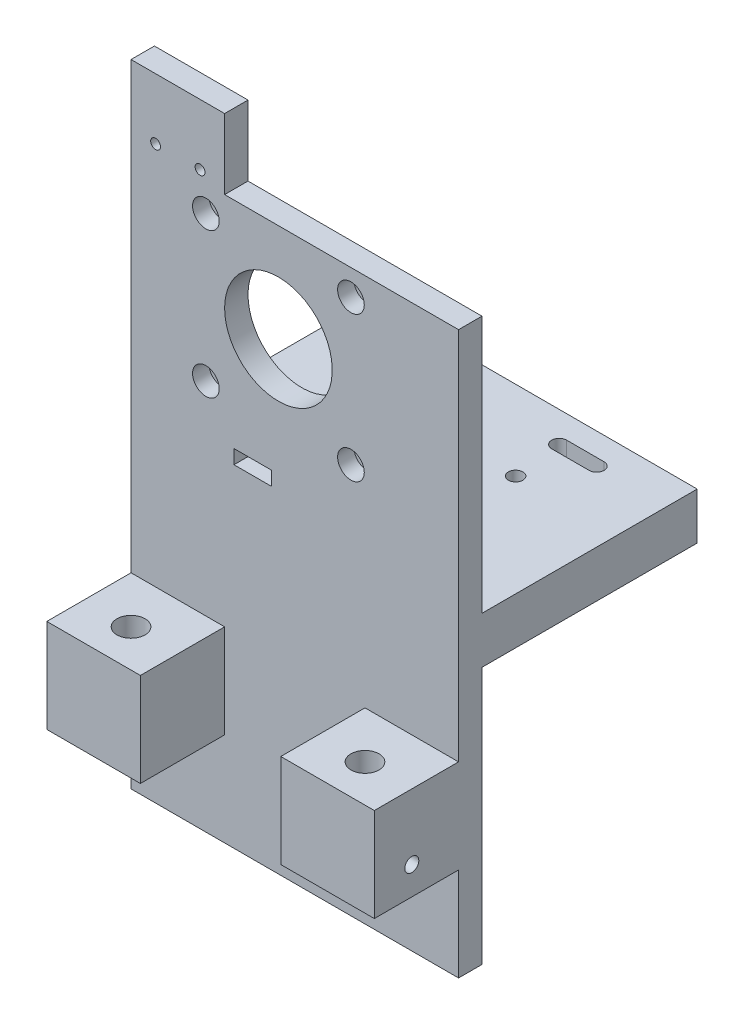
from build123d import *

# Parameters (mm, degrees)
SKETCH1_W           = 70
SKETCH1_H           = 120
BOSS_EXTRUDE1_DEPTH = 5
SKETCH2_W           = 20
SKETCH2_H           = 20
BOSS_EXTRUDE2_DEPTH = 18
CUT_EXTRUDE1_REACH  = 92.3
SKETCH3_R           = 3
CUT_EXTRUDE2_REACH  = 75.171
SKETCH4_R           = 11.5
SKETCH4_R_2         = 1.55
SKETCH5_W           = 20
SKETCH5_H           = 15
SKETCH5_R           = 1.05
BOSS_EXTRUDE3_DEPTH = 5
SKETCH6_W           = 70
SKETCH6_H           = 10
BOSS_EXTRUDE4_DEPTH = 46
SKETCH7_W           = 2.6
SKETCH7_H           = 5.7
CUT_EXTRUDE3_DEPTH  = 10
SKETCH8_R           = 1.5
CUT_EXTRUDE4_DEPTH  = 8
CUT_EXTRUDE5_START  = -8
SKETCH9_R           = 1.5
CUT_EXTRUDE5_DEPTH  = 8
SKETCH10_R          = 2.85
CUT_EXTRUDE6_DEPTH  = 3.5
CUT_EXTRUDE7_REACH  = 92.78
SKETCH11_R          = 1.55
CUT_EXTRUDE8_REACH  = 92.78
SKETCH14_W          = 8
SKETCH14_H          = 16
BOSS_EXTRUDE5_DEPTH = 4
CUT_EXTRUDE9_REACH  = 96.689
SKETCH15_W          = 8
SKETCH15_H          = 3


with BuildPart() as part:
    # Sketch1 → Boss-Extrude1 (new body)
    with BuildSketch(Plane.XY):
        Rectangle(SKETCH1_W, SKETCH1_H)
    extrude(amount=BOSS_EXTRUDE1_DEPTH)

    # Sketch2 → Boss-Extrude2 (add)
    with BuildSketch(Plane.XY.offset(5)):
        with Locations((-25, -30)):
            Rectangle(SKETCH2_W, SKETCH2_H)
        with Locations((25, -30)):
            Rectangle(SKETCH2_W, SKETCH2_H)
    extrude(amount=BOSS_EXTRUDE2_DEPTH)

    # Sketch3 → Cut-Extrude1 (cut, up to next)
    with BuildSketch(Plane(origin=(0, -20, 0), x_dir=(1, 0, 0), z_dir=(0, 1, 0)), mode=Mode.PRIVATE) as cut_extrude1_sk1:
        with Locations(Location((-25, -15, 0), (0, 0, 270))):
            Circle(SKETCH3_R)
    cut_extrude1_tool1 = extrude(cut_extrude1_sk1.sketch, amount=-CUT_EXTRUDE1_REACH, mode=Mode.PRIVATE) & part.part
    # Sketch3 → Cut-Extrude1 (cut, up to next)
    with BuildSketch(Plane(origin=(0, -20, 0), x_dir=(1, 0, 0), z_dir=(0, 1, 0)), mode=Mode.PRIVATE) as cut_extrude1_sk2:
        with Locations(Location((25, -15, 0), (0, 0, 270))):
            Circle(SKETCH3_R)
    cut_extrude1_tool2 = extrude(cut_extrude1_sk2.sketch, amount=-CUT_EXTRUDE1_REACH, mode=Mode.PRIVATE) & part.part
    add(cut_extrude1_tool1.solids().sort_by_distance((-25, -20, 15))[0], mode=Mode.SUBTRACT)
    add(cut_extrude1_tool2.solids().sort_by_distance((25, -20, 15))[0], mode=Mode.SUBTRACT)

    # Sketch4 → Cut-Extrude2 (cut, up to next)
    with BuildSketch(Plane(origin=(0, 0, 0), x_dir=(-1, 0, 0), z_dir=(0, 0, -1)), mode=Mode.PRIVATE) as cut_extrude2_sk1:
        with Locations((3.5, 39)):
            Circle(SKETCH4_R)
    cut_extrude2_tool1 = extrude(cut_extrude2_sk1.sketch, amount=-CUT_EXTRUDE2_REACH, mode=Mode.PRIVATE) & part.part
    # Sketch4 → Cut-Extrude2 (cut, up to next)
    with BuildSketch(Plane(origin=(0, 0, 0), x_dir=(-1, 0, 0), z_dir=(0, 0, -1)), mode=Mode.PRIVATE) as cut_extrude2_sk2:
        with Locations((-12, 54.5)):
            Circle(SKETCH4_R_2)
    cut_extrude2_tool2 = extrude(cut_extrude2_sk2.sketch, amount=-CUT_EXTRUDE2_REACH, mode=Mode.PRIVATE) & part.part
    # Sketch4 → Cut-Extrude2 (cut, up to next)
    with BuildSketch(Plane(origin=(0, 0, 0), x_dir=(-1, 0, 0), z_dir=(0, 0, -1)), mode=Mode.PRIVATE) as cut_extrude2_sk3:
        with Locations((19, 54.5)):
            Circle(SKETCH4_R_2)
    cut_extrude2_tool3 = extrude(cut_extrude2_sk3.sketch, amount=-CUT_EXTRUDE2_REACH, mode=Mode.PRIVATE) & part.part
    # Sketch4 → Cut-Extrude2 (cut, up to next)
    with BuildSketch(Plane(origin=(0, 0, 0), x_dir=(-1, 0, 0), z_dir=(0, 0, -1)), mode=Mode.PRIVATE) as cut_extrude2_sk4:
        with Locations((19, 23.5)):
            Circle(SKETCH4_R_2)
    cut_extrude2_tool4 = extrude(cut_extrude2_sk4.sketch, amount=-CUT_EXTRUDE2_REACH, mode=Mode.PRIVATE) & part.part
    # Sketch4 → Cut-Extrude2 (cut, up to next)
    with BuildSketch(Plane(origin=(0, 0, 0), x_dir=(-1, 0, 0), z_dir=(0, 0, -1)), mode=Mode.PRIVATE) as cut_extrude2_sk5:
        with Locations((-12, 23.5)):
            Circle(SKETCH4_R_2)
    cut_extrude2_tool5 = extrude(cut_extrude2_sk5.sketch, amount=-CUT_EXTRUDE2_REACH, mode=Mode.PRIVATE) & part.part
    add(cut_extrude2_tool1.solids().sort_by_distance((-3.5, 39, 0))[0], mode=Mode.SUBTRACT)
    add(cut_extrude2_tool2.solids().sort_by_distance((12, 54.5, 0))[0], mode=Mode.SUBTRACT)
    add(cut_extrude2_tool3.solids().sort_by_distance((-19, 54.5, 0))[0], mode=Mode.SUBTRACT)
    add(cut_extrude2_tool4.solids().sort_by_distance((-19, 23.5, 0))[0], mode=Mode.SUBTRACT)
    add(cut_extrude2_tool5.solids().sort_by_distance((12, 23.5, 0))[0], mode=Mode.SUBTRACT)

    # Sketch5 → Boss-Extrude3 (add)
    with BuildSketch(Plane(origin=(0, 0, 0), x_dir=(-1, 0, 0), z_dir=(0, 0, -1))):
        with Locations((25, 67.5)):
            Rectangle(SKETCH5_W, SKETCH5_H)
        with Locations((20.25, 62)):
            Circle(SKETCH5_R, mode=Mode.SUBTRACT)
        with Locations((29.75, 62)):
            Circle(SKETCH5_R, mode=Mode.SUBTRACT)
    extrude(amount=-BOSS_EXTRUDE3_DEPTH)

    # Sketch6 → Boss-Extrude4 (add)
    with BuildSketch(Plane(origin=(0, 0, 0), x_dir=(-1, 0, 0), z_dir=(0, 0, -1))):
        Rectangle(SKETCH6_W, SKETCH6_H)
    extrude(amount=BOSS_EXTRUDE4_DEPTH)

    # Sketch7 → Cut-Extrude3 (cut)
    with BuildSketch(Plane(origin=(0, -40, 0), x_dir=(1, 0, 0), z_dir=(0, 1, 0))):
        with Locations((30.7, -15)):
            Rectangle(SKETCH7_W, SKETCH7_H)
        with Locations((-30.7, -15)):
            Rectangle(SKETCH7_W, SKETCH7_H)
    extrude(amount=CUT_EXTRUDE3_DEPTH, mode=Mode.SUBTRACT)

    # Sketch8 → Cut-Extrude4 (cut)
    with BuildSketch(Plane(origin=(35, 0, 0), x_dir=(0, 0, -1), z_dir=(1, 0, 0))):
        with Locations((-15, -34)):
            Circle(SKETCH8_R)
    extrude(amount=-CUT_EXTRUDE4_DEPTH, mode=Mode.SUBTRACT)

    # Sketch9 → Cut-Extrude5 (cut)
    with BuildSketch(Plane.ZY.offset(35).offset(CUT_EXTRUDE5_START)):
        with Locations(Location((15, -34, 0), (0, 0, 180))):
            Circle(SKETCH9_R)
    extrude(amount=CUT_EXTRUDE5_DEPTH, mode=Mode.SUBTRACT)

    # Sketch10 → Cut-Extrude6 (cut)
    with BuildSketch(Plane.XY.offset(5)):
        with Locations((-19, 54.5)):
            Circle(SKETCH10_R)
        with Locations((12, 54.5)):
            Circle(SKETCH10_R)
        with Locations((12, 23.5)):
            Circle(SKETCH10_R)
        with Locations((-19, 23.5)):
            Circle(SKETCH10_R)
    extrude(amount=-CUT_EXTRUDE6_DEPTH, mode=Mode.SUBTRACT)

    # Sketch11 → Cut-Extrude7 (cut, up to next)
    with BuildSketch(Plane(origin=(0, 5, 0), x_dir=(1, 0, 0), z_dir=(0, 1, 0)), mode=Mode.PRIVATE) as cut_extrude7_sk1:
        with Locations(Location((-11.805993826, 29, 0), (0, 0, 270))):
            Circle(SKETCH11_R)
    cut_extrude7_tool1 = extrude(cut_extrude7_sk1.sketch, amount=-CUT_EXTRUDE7_REACH, mode=Mode.PRIVATE) & part.part
    # Sketch11 → Cut-Extrude7 (cut, up to next)
    with BuildSketch(Plane(origin=(0, 5, 0), x_dir=(1, 0, 0), z_dir=(0, 1, 0)), mode=Mode.PRIVATE) as cut_extrude7_sk2:
        with Locations(Location((-11.805993826, 4, 0), (0, 0, 270))):
            Circle(SKETCH11_R)
    cut_extrude7_tool2 = extrude(cut_extrude7_sk2.sketch, amount=-CUT_EXTRUDE7_REACH, mode=Mode.PRIVATE) & part.part
    # Sketch11 → Cut-Extrude7 (cut, up to next)
    with BuildSketch(Plane(origin=(0, 5, 0), x_dir=(1, 0, 0), z_dir=(0, 1, 0)), mode=Mode.PRIVATE) as cut_extrude7_sk3:
        with Locations(Location((13.194006174, 29, 0), (0, 0, 270))):
            Circle(SKETCH11_R)
    cut_extrude7_tool3 = extrude(cut_extrude7_sk3.sketch, amount=-CUT_EXTRUDE7_REACH, mode=Mode.PRIVATE) & part.part
    # Sketch11 → Cut-Extrude7 (cut, up to next)
    with BuildSketch(Plane(origin=(0, 5, 0), x_dir=(1, 0, 0), z_dir=(0, 1, 0)), mode=Mode.PRIVATE) as cut_extrude7_sk4:
        with Locations(Location((13.194006174, 4, 0), (0, 0, 270))):
            Circle(SKETCH11_R)
    cut_extrude7_tool4 = extrude(cut_extrude7_sk4.sketch, amount=-CUT_EXTRUDE7_REACH, mode=Mode.PRIVATE) & part.part
    add(cut_extrude7_tool1.solids().sort_by_distance((-11.805994, 5, -29))[0], mode=Mode.SUBTRACT)
    add(cut_extrude7_tool2.solids().sort_by_distance((-11.805994, 5, -4))[0], mode=Mode.SUBTRACT)
    add(cut_extrude7_tool3.solids().sort_by_distance((13.194006, 5, -29))[0], mode=Mode.SUBTRACT)
    add(cut_extrude7_tool4.solids().sort_by_distance((13.194006, 5, -4))[0], mode=Mode.SUBTRACT)

    # Sketch13 → Cut-Extrude8 (cut, up to next)
    with BuildSketch(Plane(origin=(0, 5, 0), x_dir=(1, 0, 0), z_dir=(0, 1, 0)), mode=Mode.PRIVATE) as cut_extrude8_sk1:
        with BuildLine():
            Line((-20, 41.1), (-12, 41.1))
            ThreePointArc((-12, 41.1), (-10.4, 39.5), (-12, 37.9))
            Line((-12, 37.9), (-20, 37.9))
            ThreePointArc((-20, 37.9), (-21.6, 39.5), (-20, 41.1))
        make_face()
    cut_extrude8_tool1 = extrude(cut_extrude8_sk1.sketch, amount=-CUT_EXTRUDE8_REACH, mode=Mode.PRIVATE) & part.part
    # Sketch13 → Cut-Extrude8 (cut, up to next)
    with BuildSketch(Plane(origin=(0, 5, 0), x_dir=(1, 0, 0), z_dir=(0, 1, 0)), mode=Mode.PRIVATE) as cut_extrude8_sk2:
        with BuildLine():
            Line((20, 41.1), (12, 41.1))
            ThreePointArc((12, 41.1), (10.4, 39.5), (12, 37.9))
            Line((12, 37.9), (20, 37.9))
            ThreePointArc((20, 37.9), (21.6, 39.5), (20, 41.1))
        make_face()
    cut_extrude8_tool2 = extrude(cut_extrude8_sk2.sketch, amount=-CUT_EXTRUDE8_REACH, mode=Mode.PRIVATE) & part.part
    add(cut_extrude8_tool1.solids().sort_by_distance((-16, 5, -39.5))[0], mode=Mode.SUBTRACT)
    add(cut_extrude8_tool2.solids().sort_by_distance((16, 5, -39.5))[0], mode=Mode.SUBTRACT)

    # Sketch14 → Boss-Extrude5 (add)
    with BuildSketch(Plane.ZY.offset(35)):
        with Locations((-4, -13)):
            Rectangle(SKETCH14_W, SKETCH14_H)
    extrude(amount=-BOSS_EXTRUDE5_DEPTH)

    # Sketch15 → Cut-Extrude9 (cut, up to next)
    with BuildSketch(Plane(origin=(0, 0, 0), x_dir=(-1, 0, 0), z_dir=(0, 0, -1)), mode=Mode.PRIVATE) as cut_extrude9_sk1:
        with Locations((9, 12.5)):
            Rectangle(SKETCH15_W, SKETCH15_H)
    cut_extrude9_tool1 = extrude(cut_extrude9_sk1.sketch, amount=-CUT_EXTRUDE9_REACH, mode=Mode.PRIVATE) & part.part
    add(cut_extrude9_tool1.solids().sort_by_distance((-9, 12.5, 0))[0], mode=Mode.SUBTRACT)


solid = part.part
